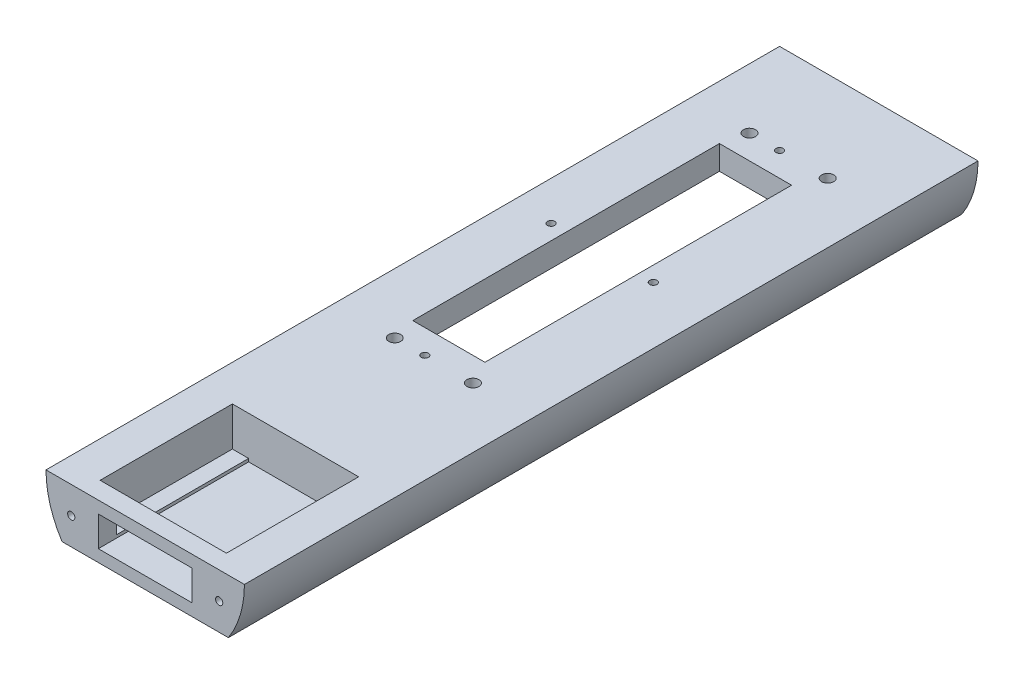
from build123d import *

# Parameters (mm, degrees)
SKETCH_1_W          = 33
SKETCH_1_H          = 122
EXTRUDE_1_DEPTH     = 9
SKETCH_2_W          = 12
SKETCH_2_H          = 51
SKETCH_2_W_2        = 21
SKETCH_2_H_2        = 22
CUT_EXTRUDE_1_DEPTH = 127.70438035
SKETCH_2_2_W        = 21
SKETCH_2_2_H        = 22
EXTRUDE_2_DEPTH     = 2.5
SKETCH_3_W          = 22
SKETCH_3_H          = 67
CUT_EXTRUDE_2_DEPTH = 5
SKETCH_4_R          = 1
CUT_EXTRUDE_3_DEPTH = 127.483200466
SKETCH_4_3_R        = 2
CUT_EXTRUDE_4_DEPTH = 2
SKETCH_5_R          = 0.6
CUT_EXTRUDE_5_DEPTH = 127.483200466
SKETCH_6_OUTSIDE_W  = 60.34
SKETCH_6_OUTSIDE_H  = 36.34
SKETCH_6_OUTSIDE_R  = 16.5
CUT_EXTRUDE_6_DEPTH = 127.70438035
CUT_EXTRUDE_7_REACH = 128.704
SKETCH_7_W          = 15.6
SKETCH_7_H          = 5
SKETCH_7_3_R        = 0.6
CUT_EXTRUDE_8_DEPTH = 3


with BuildPart() as part:
    # 草图1 → 凸台-拉伸1 (new body)
    with BuildSketch(Plane(origin=(0, 0, 0), x_dir=(1, 0, 0), z_dir=(0, 1, 0))):
        with Locations((16.5, -61)):
            Rectangle(SKETCH_1_W, SKETCH_1_H)
    extrude(amount=EXTRUDE_1_DEPTH)

    # 草图2 → 切除-拉伸1 (cut, through all)
    with BuildSketch(Plane.XZ):
        with Locations((15, 44.5)):
            Rectangle(SKETCH_2_W, SKETCH_2_H)
        with Locations((16.5, 108)):
            Rectangle(SKETCH_2_W_2, SKETCH_2_H_2)
    extrude(amount=-CUT_EXTRUDE_1_DEPTH, mode=Mode.SUBTRACT)

    # 草图2<2> → 凸台-拉伸2 (add)
    with BuildSketch(Plane.XZ):
        with Locations((16.5, 108)):
            Rectangle(SKETCH_2_2_W, SKETCH_2_2_H)
    extrude(amount=-EXTRUDE_2_DEPTH)

    # 草图3 → 切除-拉伸2 (cut)
    with BuildSketch(Plane.XZ):
        with Locations((15, 44.5)):
            Rectangle(SKETCH_3_W, SKETCH_3_H)
    extrude(amount=-CUT_EXTRUDE_2_DEPTH, mode=Mode.SUBTRACT)

    # 草图4 → 切除-拉伸3 (cut, through all)
    with BuildSketch(Plane.XZ.offset(-5)):
        with Locations(Location((23, 74, 0), (0, 0, 270))):
            Circle(SKETCH_4_R)
        with Locations(Location((10, 74, 0), (0, 0, 270))):
            Circle(SKETCH_4_R)
        with Locations(Location((23, 15, 0), (0, 0, 270))):
            Circle(SKETCH_4_R)
        with Locations(Location((10, 15, 0), (0, 0, 270))):
            Circle(SKETCH_4_R)
    extrude(amount=-CUT_EXTRUDE_3_DEPTH, mode=Mode.SUBTRACT)

    # 草图4<3> → 切除-拉伸4 (cut)
    with BuildSketch(Plane.XZ.offset(-5)):
        with Locations(Location((10, 74, 0), (0, 0, 270))):
            Circle(SKETCH_4_3_R)
        with Locations(Location((23, 74, 0), (0, 0, 270))):
            Circle(SKETCH_4_3_R)
        with Locations(Location((23, 15, 0), (0, 0, 270))):
            Circle(SKETCH_4_3_R)
        with Locations(Location((10, 15, 0), (0, 0, 270))):
            Circle(SKETCH_4_3_R)
    extrude(amount=-CUT_EXTRUDE_4_DEPTH, mode=Mode.SUBTRACT)

    # 草图5 → 切除-拉伸5 (cut, through all)
    with BuildSketch(Plane.XZ.offset(-5)):
        with Locations(Location((15, 74, 0), (0, 0, 270))):
            Circle(SKETCH_5_R)
        with Locations(Location((6.5, 44.5, 0), (0, 0, 270))):
            Circle(SKETCH_5_R)
        with Locations(Location((23.5, 44.5, 0), (0, 0, 270))):
            Circle(SKETCH_5_R)
        with Locations(Location((15, 15, 0), (0, 0, 270))):
            Circle(SKETCH_5_R)
    extrude(amount=-CUT_EXTRUDE_5_DEPTH, mode=Mode.SUBTRACT)

    # 草图6 outside → 切除-拉伸6 (cut, through all)
    with BuildSketch(Plane.XY.offset(122)):
        with Locations((16.5, 4.5)):
            Rectangle(SKETCH_6_OUTSIDE_W, SKETCH_6_OUTSIDE_H)
        with Locations((16.5, 9)):
            Circle(SKETCH_6_OUTSIDE_R, mode=Mode.SUBTRACT)
    extrude(amount=-CUT_EXTRUDE_6_DEPTH, mode=Mode.SUBTRACT)

    # 切除-拉伸7: up to this face of the body (flat: up to its plane)
    cut_extrude_7_end = Plane(part.part.faces().sort_by_distance((16.5, 5.75, 97))[0])
    # 草图7 → 切除-拉伸7 (cut, up to the picked face)
    with BuildSketch(Plane.XY.offset(122), mode=Mode.PRIVATE) as cut_extrude_7_sk1:
        with Locations((16.5, 4.5)):
            Rectangle(SKETCH_7_W, SKETCH_7_H)
    cut_extrude_7_tool1 = split(extrude(cut_extrude_7_sk1.sketch, amount=-CUT_EXTRUDE_7_REACH, mode=Mode.PRIVATE), bisect_by=cut_extrude_7_end, keep=Keep.BOTH, mode=Mode.PRIVATE)
    add(cut_extrude_7_tool1.solids().sort_by(Axis((16.5, 4.5, 122), (0, 0, -1)))[0], mode=Mode.SUBTRACT)

    # 草图7<3> → 切除-拉伸8 (cut)
    with BuildSketch(Plane.XY.offset(122)):
        with Locations((4.2, 4.5)):
            Circle(SKETCH_7_3_R)
        with Locations((28.8, 4.5)):
            Circle(SKETCH_7_3_R)
    extrude(amount=-CUT_EXTRUDE_8_DEPTH, mode=Mode.SUBTRACT)


solid = part.part
